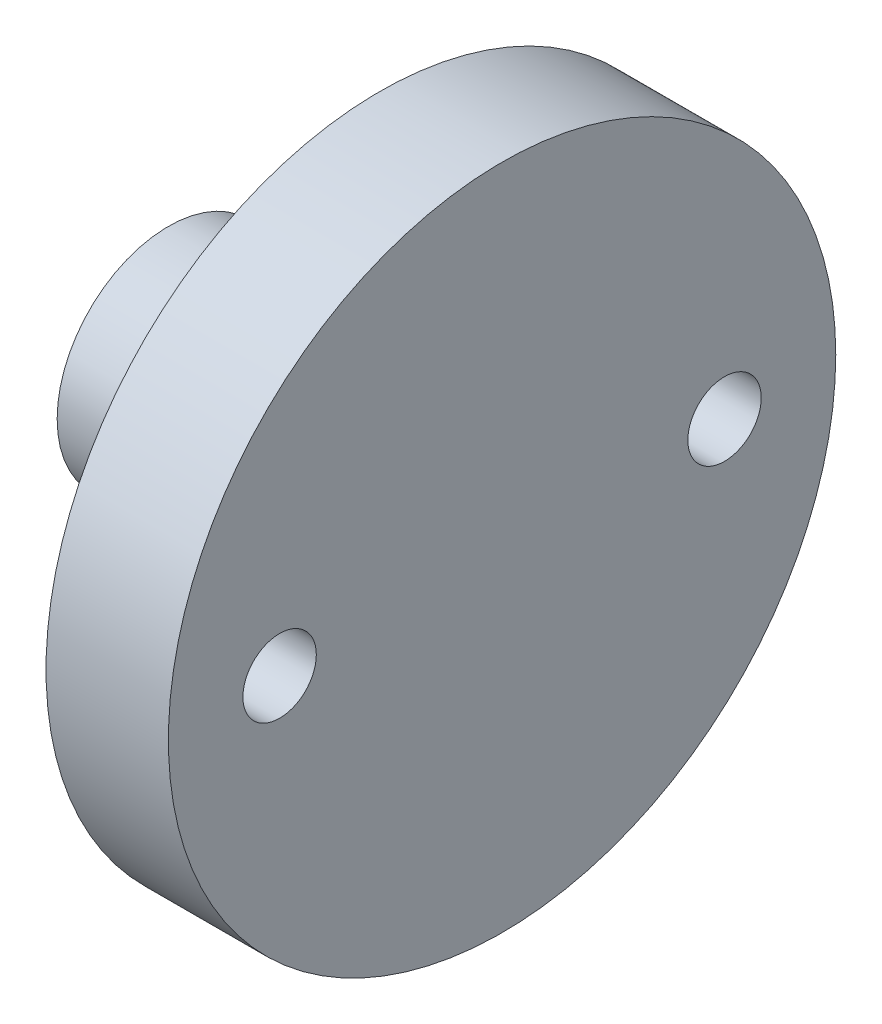
from build123d import *

# Parameters (mm, degrees)
SKETCH_1_R          = 15
EXTRUDE_1_DEPTH     = 5.5
SKETCH_2_R          = 6
EXTRUDE_2_DEPTH     = 2
SKETCH_3_R          = 5
EXTRUDE_3_DEPTH     = 7.5
SKETCH_4_R          = 1.65
CUT_EXTRUDE_1_DEPTH = 26.980762114


with BuildPart() as part:
    # ｽｹｯﾁ1 → ﾎﾞｽ - 押し出し1 (new body)
    with BuildSketch(Plane(origin=(0, 0, 0), x_dir=(0, 0, -1), z_dir=(1, 0, 0))):
        Circle(SKETCH_1_R)
    extrude(amount=EXTRUDE_1_DEPTH)

    # ｽｹｯﾁ2 → ﾎﾞｽ - 押し出し2 (add)
    with BuildSketch(Plane.ZY):
        Circle(SKETCH_2_R)
    extrude(amount=EXTRUDE_2_DEPTH)

    # ｽｹｯﾁ3 → ﾎﾞｽ - 押し出し3 (add)
    with BuildSketch(Plane.ZY.offset(2)):
        Circle(SKETCH_3_R)
    extrude(amount=EXTRUDE_3_DEPTH)

    # ｽｹｯﾁ4 → ｶｯﾄ - 押し出し1 (cut, through all)
    with BuildSketch(Plane(origin=(5.5, 0, 0), x_dir=(0, 0, -1), z_dir=(1, 0, 0))):
        with Locations((10, 0)):
            Circle(SKETCH_4_R)
        with Locations((-10, 0)):
            Circle(SKETCH_4_R)
    extrude(amount=-CUT_EXTRUDE_1_DEPTH, mode=Mode.SUBTRACT)


solid = part.part
